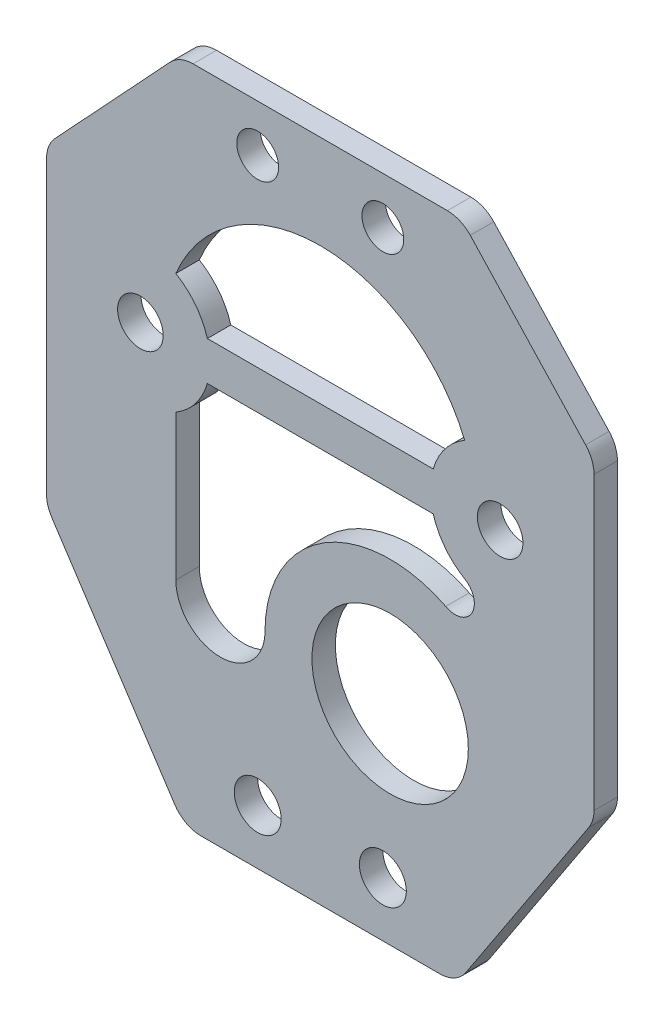
from build123d import *

# Parameters (mm, degrees)
SKETCH1_R           = 2.915712225
SKETCH1_R_2         = 2.67310125
SKETCH1_R_3         = 3
SKETCH1_R_4         = 10
BOSS_EXTRUDE2_DEPTH = 3
FILLET1_R           = 4


with BuildPart() as part:
    # Sketch1 → Boss-Extrude2 (new body)
    with BuildSketch(Plane.XY):
        Polygon((17.4253449, 0), (-17.4253449, 0), (-35, 26.741942676), (-35, 66.741942676), (-18, 85), (18, 85), (35, 66.741942676), (35, 26.741942676), align=None)
        with Locations((-23, 53)):
            Circle(SKETCH1_R, mode=Mode.SUBTRACT)
        with Locations((-8, 79)):
            Circle(SKETCH1_R_2, mode=Mode.SUBTRACT)
        with Locations((-8, 7)):
            Circle(SKETCH1_R_3, mode=Mode.SUBTRACT)
        with Locations(Location((8, 7, 0), (0, 0, 180))):
            Circle(SKETCH1_R_3, mode=Mode.SUBTRACT)
        with Locations(Location((23, 53, 0), (0, 0, 180))):
            Circle(SKETCH1_R, mode=Mode.SUBTRACT)
        with Locations(Location((8, 79, 0), (0, 0, 180))):
            Circle(SKETCH1_R_2, mode=Mode.SUBTRACT)
        with Locations((8.931523687, 26.741942676)):
            Circle(SKETCH1_R_4, mode=Mode.SUBTRACT)
        with BuildLine():
            Line((-14.43882876, 55.489231101), (14.43882876, 55.489231101))
            ThreePointArc((14.43882876, 55.489231101), (15.957952298, 58.468042486), (18.467610338, 60.677718959))
            ThreePointArc((18.467610338, 60.677718959), (0, 73), (-18.467610338, 60.677718959))
            ThreePointArc((-18.467610338, 60.677718959), (-15.957952298, 58.468042486), (-14.43882876, 55.489231101))
        make_face(mode=Mode.SUBTRACT)
        with BuildLine():
            Line((-14.43882876, 50.510768899), (14.43882876, 50.510768899))
            ThreePointArc((14.43882876, 50.510768899), (15.957952298, 47.531957514), (18.467610338, 45.322281041))
            ThreePointArc((18.467610338, 45.322281041), (19.38241537, 41.987278709), (16.047413038, 41.072473676))
            ThreePointArc((16.047413038, 41.072473676), (0.501050083, 40.340733608), (-7.068476313, 26.741942676))
            ThreePointArc((-7.068476313, 26.741942676), (-12.768043325, 21.042375664), (-18.467610338, 26.741942676))
            Line((-18.467610338, 26.741942676), (-18.467610338, 45.322281041))
            ThreePointArc((-18.467610338, 45.322281041), (-15.957952298, 47.531957514), (-14.43882876, 50.510768899))
        make_face(mode=Mode.SUBTRACT)
    extrude(amount=BOSS_EXTRUDE2_DEPTH)

    # Fillet1
    fillet1_edges = [part.edges().sort_by_distance(p)[0] for p in [
        (-35, 26.741942676, 1.5),
        (-35, 66.741942676, 1.5),
        (-18, 85, 1.5),
        (18, 85, 1.5),
        (35, 66.741942676, 1.5),
        (35, 26.741942676, 1.5),
        (17.4253449, 0, 1.5),
        (-17.4253449, 0, 1.5),
    ]]
    fillet(fillet1_edges, radius=FILLET1_R)


solid = part.part
